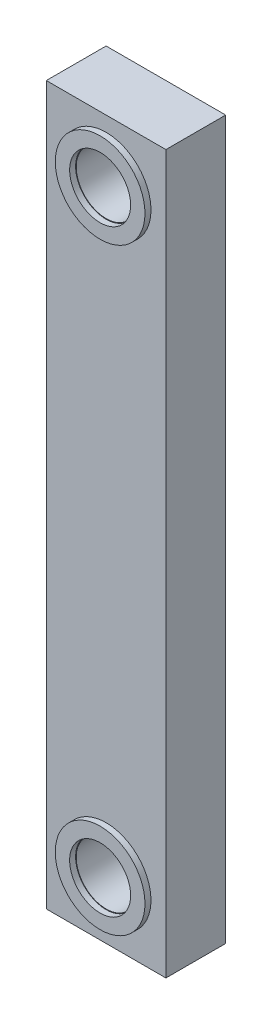
from build123d import *

# Parameters (mm, degrees)
SKIZZE1_W                       = 20
SKIZZE1_H                       = 120
AUFSATZ_LINEAR_AUSTRAGEN1_DEPTH = 10
SKIZZE2_R                       = 7.5
SKIZZE2_R_2                     = 5.1
AUFSATZ_LINEAR_AUSTRAGEN3_DEPTH = 1
SKIZZE5_R                       = 5
SCHNITT_LINEAR_AUSTRAGEN1_DEPTH = 10


with BuildPart() as part:
    # Skizze1 → Aufsatz-Linear austragen1 (new body)
    with BuildSketch(Plane.XY):
        with Locations((10, 60)):
            Rectangle(SKIZZE1_W, SKIZZE1_H)
    extrude(amount=AUFSATZ_LINEAR_AUSTRAGEN1_DEPTH)

    # Skizze2 → Aufsatz-Linear austragen3 (add)
    # profile 1 of 2: a face of its own
    with BuildSketch(Plane.XY.offset(10)):
        with Locations(Location((10, 110, 0), (0, 0, 180))):
            Circle(SKIZZE2_R)
        with Locations((10, 110)):
            Circle(SKIZZE2_R_2, mode=Mode.SUBTRACT)
    # profile 2 of 2: a face of its own
    with BuildSketch(Plane.XY.offset(10)):
        with Locations(Location((10, 10, 0), (0, 0, 180))):
            Circle(SKIZZE2_R)
        with Locations((10, 10)):
            Circle(SKIZZE2_R_2, mode=Mode.SUBTRACT)
    extrude(amount=AUFSATZ_LINEAR_AUSTRAGEN3_DEPTH)

    # Skizze5 → Schnitt-Linear austragen1 (cut)
    with BuildSketch(Plane.XY.offset(10)):
        with Locations((10, 110)):
            Circle(SKIZZE5_R)
        with Locations((10, 10)):
            Circle(SKIZZE5_R)
    extrude(amount=-SCHNITT_LINEAR_AUSTRAGEN1_DEPTH, mode=Mode.SUBTRACT)


solid = part.part
